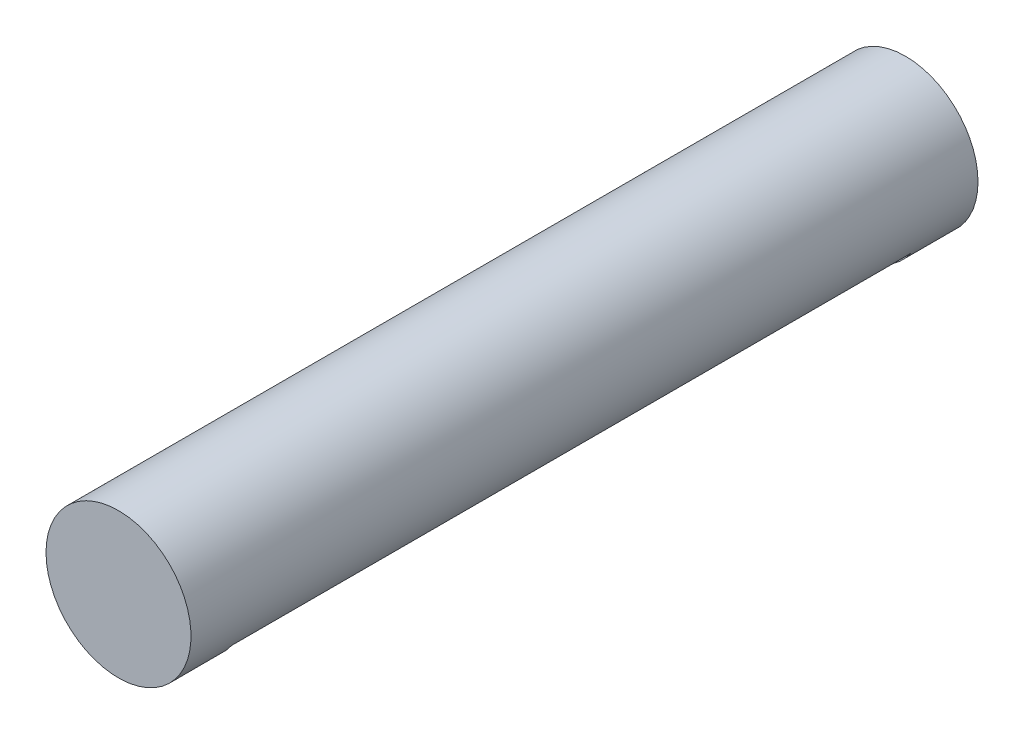
from build123d import *

# Parameters (mm, degrees)
ESBO_O1_R                  = 35
RESSALTO_EXTRUS_O1_DEPTH   = 380
CORTE_EXTRUS_O1_DEPTH      = 452.497508299
CORTE_EXTRUS_O1_DEPTH_BACK = 10
ESBO_O2_W                  = 117.966438478
ESBO_O2_H                  = 328


with BuildPart() as part:
    # Esboço1 → Ressalto-extrusão1 (new body)
    with BuildSketch(Plane.XY):
        with Locations(Location((200, -240, 0), (0, 0, 180))):
            Circle(ESBO_O1_R)
    extrude(amount=RESSALTO_EXTRUS_O1_DEPTH)

    # Esboço2 → Corte-extrusão1 (cut, two sides: drawn at the far end of the back side and taken through both)
    with BuildSketch(Plane.XZ.offset(270).offset(-CORTE_EXTRUS_O1_DEPTH_BACK)):
        with Locations((200.62416105, 190)):
            Rectangle(ESBO_O2_W, ESBO_O2_H)
    extrude(amount=CORTE_EXTRUS_O1_DEPTH + CORTE_EXTRUS_O1_DEPTH_BACK, mode=Mode.SUBTRACT)


solid = part.part
